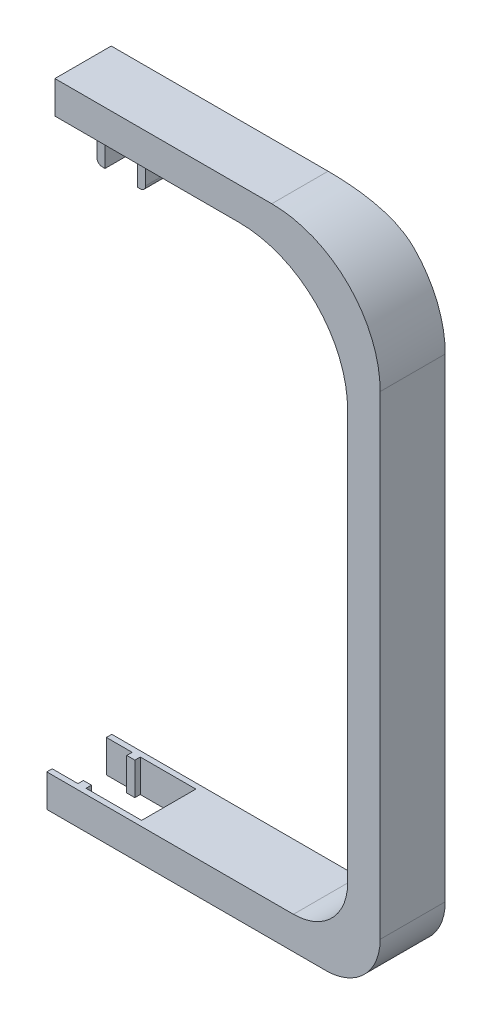
from build123d import *

# Parameters (mm, degrees)
EXTRUDE_1_DEPTH     = 12
EXTRUDE_2_DEPTH     = 24
SKETCH_6_W          = 3
SKETCH_6_H          = 15
EXTRUDE_3_DEPTH     = 12
EXTRUDE_4_DEPTH     = 24
CUT_EXTRUDE_4_DEPTH = 267.326866838
CUT_EXTRUDE_5_DEPTH = 265.954713112
FILLET_1_R          = 2


with BuildPart() as part:
    # 草图1 → 凸台-拉伸1 (new body)
    with BuildSketch(Plane(origin=(0, 0, 0), x_dir=(1, 0, 0), z_dir=(0, 1, 0))):
        Polygon((-123, 2), (-123, 0), (0, 0), (0, 24), (-123, 24), (-123, 22), (-113.5, 22), (-113.5, 20), (-110.5, 20), (-110.5, 22), (-90, 22), (-90, 2), (-110.5, 2), (-110.5, 4), (-113.5, 4), (-113.5, 2), align=None)
    extrude(amount=EXTRUDE_1_DEPTH)

    # 草图5 → 凸台-拉伸2 (add)
    with BuildSketch(Plane(origin=(0, 0, -24), x_dir=(-1, 0, 0), z_dir=(0, 0, -1))):
        with BuildLine():
            Line((0, 0), (12, 0))
            Line((12, 0), (12, 183))
            ThreePointArc((12, 183), (23.715728753, 211.284271247), (52, 223))
            Line((52, 223), (120, 223))
            Line((120, 223), (120, 235))
            Line((120, 235), (40, 235))
            ThreePointArc((40, 235), (11.715728753, 223.284271247), (0, 195))
            Line((0, 195), (0, 0))
        make_face()
    extrude(amount=-EXTRUDE_2_DEPTH)

    # 草图6 → 凸台-拉伸3 (add)
    with BuildSketch(Plane.XZ.offset(-223)):
        with Locations((-107.5, -12)):
            Rectangle(SKETCH_6_W, SKETCH_6_H)
        with Locations((-92.5, -12)):
            Rectangle(SKETCH_6_W, SKETCH_6_H)
    extrude(amount=EXTRUDE_3_DEPTH)

    # 草图7 → 凸台-拉伸4 (add)
    with BuildSketch(Plane(origin=(0, 0, -24), x_dir=(-1, 0, 0), z_dir=(0, 0, -1))):
        with BuildLine():
            Line((32, 12), (12, 12))
            Line((12, 12), (12, 32))
            ThreePointArc((12, 32), (17.857864376, 17.857864376), (32, 12))
        make_face()
    extrude(amount=-EXTRUDE_4_DEPTH)

    # 草图8 → 切除-拉伸4 (cut, through all)
    with BuildSketch(Plane(origin=(0, 0, -24), x_dir=(-1, 0, 0), z_dir=(0, 0, -1))):
        with BuildLine():
            Line((0, 20), (0, 0))
            Line((0, 0), (20, 0))
            ThreePointArc((20, 0), (5.857864376, 5.857864376), (0, 20))
        make_face()
    extrude(amount=-CUT_EXTRUDE_4_DEPTH, mode=Mode.SUBTRACT)

    # 草图9 → 切除-拉伸5 (cut, through all)
    with BuildSketch(Plane.ZY.offset(120)):
        with BuildLine():
            Line((-24, 235), (-24, 223))
            ThreePointArc((-24, 223), (-23.182219831, 229.211657082), (-20.784609691, 235))
            Line((-20.784609691, 235), (-24, 235))
        make_face()
    extrude(amount=-CUT_EXTRUDE_5_DEPTH, mode=Mode.SUBTRACT)

    # 圆角1
    fillet_1_edges = [part.edges().sort_by_distance(p)[0] for p in [
        (-109, 211, -12),
        (-91, 211, -12),
    ]]
    fillet(fillet_1_edges, radius=FILLET_1_R)


solid = part.part
